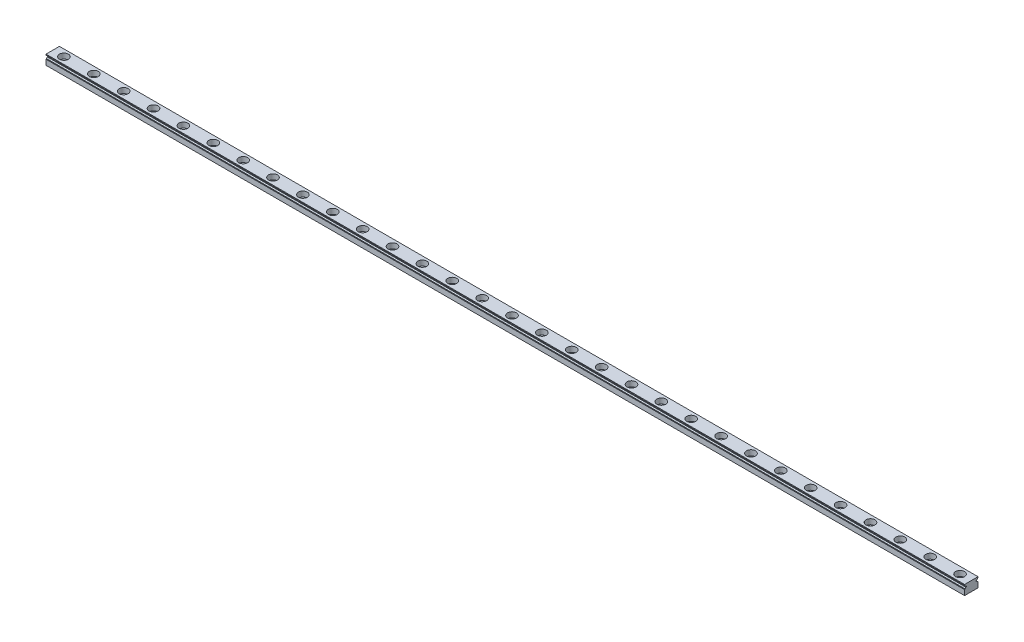
from build123d import *

# Parameters (mm, degrees)
BOSS_EXTRU_1_DEPTH                                 = 615
ESQUISSE2_W                                        = 0.3
ESQUISSE2_H                                        = 2.4
ENL_V_MAT_EXTRU_1_DEPTH                            = 616.050810909
CHAMBRAGE_POUR_VIS_T_TE_HEXAGONALE_M31_D           = 3.5
CHAMBRAGE_POUR_VIS_T_TE_HEXAGONALE_M31_CBORE_D     = 6
CHAMBRAGE_POUR_VIS_T_TE_HEXAGONALE_M31_CBORE_DEPTH = 3.5
R_P_TITION_LIN_AIRE1_COUNT                         = 31
R_P_TITION_LIN_AIRE1_PITCH                         = 20


with BuildPart() as part:
    # Esquisse1 → Boss.-Extru.1 (new body)
    with BuildSketch(Plane(origin=(0, 0, 0), x_dir=(0, 0, -1), z_dir=(1, 0, 0))):
        Polygon((-4.5, 0), (4.5, 0), (4.5, 3.5), (3.6, 4.4), (3.3, 4.4), (3.3, 5), (3.6, 5), (4.5, 5.9), (4.5, 6.5), (-4.5, 6.5), (-4.5, 5.9), (-3.6, 5), (-3.3, 5), (-3.3, 4.4), (-3.6, 4.4), (-4.5, 3.5), align=None)
    extrude(amount=BOSS_EXTRU_1_DEPTH)

    # Esquisse2 → Enlèv. mat.-Extru.1 (cut, through all)
    with BuildSketch(Plane(origin=(0, 0, 0), x_dir=(0, 0, -1), z_dir=(1, 0, 0))):
        with Locations((4.35, 4.7)):
            Rectangle(ESQUISSE2_W, ESQUISSE2_H)
        with Locations((-4.35, 4.7)):
            Rectangle(ESQUISSE2_W, ESQUISSE2_H)
    extrude(amount=ENL_V_MAT_EXTRU_1_DEPTH, mode=Mode.SUBTRACT)

    # Chambrage pour vis à tête hexagonale M31 (through all)
    with Locations(Plane(origin=(0, 6.5, 0), x_dir=(1, 0, 0), z_dir=(0, 1, 0))):
        with Locations((7.5, 0)):
            chambrage_pour_vis_t_te_hexagonale_m31 = CounterBoreHole(CHAMBRAGE_POUR_VIS_T_TE_HEXAGONALE_M31_D / 2, CHAMBRAGE_POUR_VIS_T_TE_HEXAGONALE_M31_CBORE_D / 2, CHAMBRAGE_POUR_VIS_T_TE_HEXAGONALE_M31_CBORE_DEPTH)

    # Répétition linéaire1: Chambrage pour vis à tête hexagonale M31 ×31
    with Locations(*[(i * R_P_TITION_LIN_AIRE1_PITCH, 0, 0) for i in range(1, R_P_TITION_LIN_AIRE1_COUNT)]):
        add(chambrage_pour_vis_t_te_hexagonale_m31, mode=Mode.SUBTRACT)


solid = part.part
